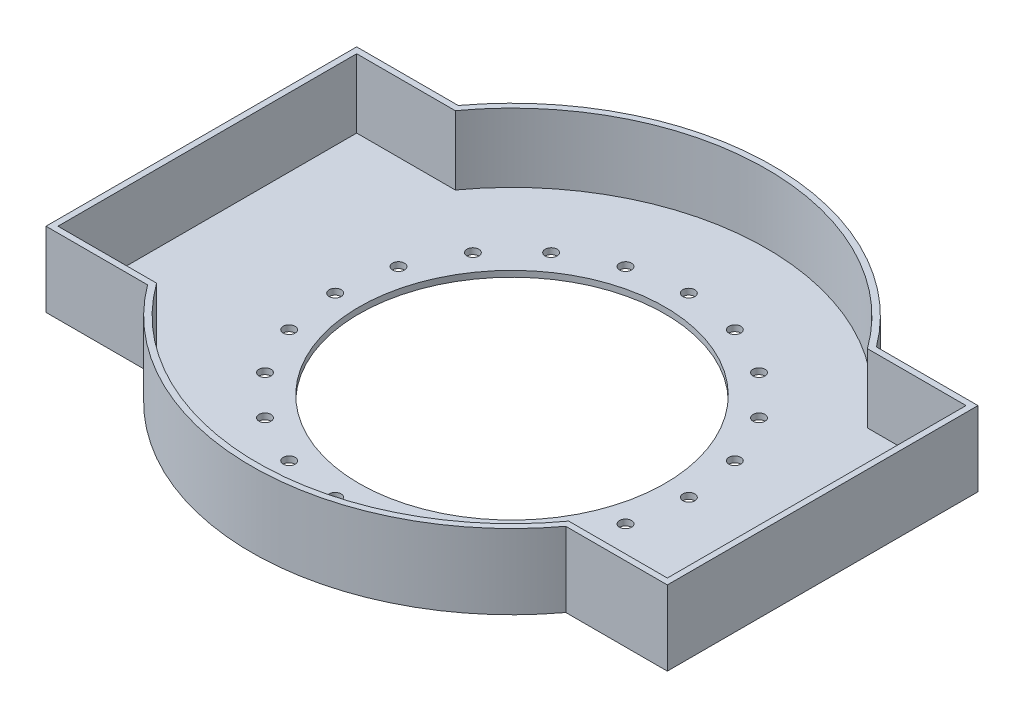
from build123d import *

# Parameters (mm, degrees)
ESQUISSE2_R                  = 10
ENL_V_MAT_EXTRU_1_DEPTH      = 687.62944883
R_P_TITION_CIRCULAIRE1_COUNT = 20
BOSS_EXTRU_1_START           = -10
ESQUISSE5_R                  = 436
ESQUISSE5_R_2                = 336
BOSS_EXTRU_1_DEPTH           = 10
BOSS_EXTRU_2_START           = 115
ESQUISSE6_R                  = 436
ESQUISSE6_R_2                = 426
BOSS_EXTRU_2_DEPTH           = 115
BOSS_EXTRU_3_START           = -10
BOSS_EXTRU_3_DEPTH           = 10
BOSS_EXTRU_4_START           = 115
BOSS_EXTRU_4_DEPTH           = 115
ENL_V_MAT_EXTRU_3_DEPTH      = 115
R_P_TITION_CIRCULAIRE6_COUNT = 2
ESQUISSE10_R                 = 336
ENL_V_MAT_EXTRU_4_DEPTH      = 80


with BuildPart() as part:
    # Esquisse1 → Révolution1 (revolve)
    with BuildSketch(Plane.XY, mode=Mode.PRIVATE) as r_volution1_sk:
        with BuildLine():
            Line((0, 0), (80, 0))
            Line((80, 0), (80, 52.5))
            ThreePointArc((80, 52.5), (70, 62.5), (80, 72.5))
            Line((80, 72.5), (80, 90))
            Line((80, 90), (0, 90))
            Line((0, 90), (0, 0))
        make_face()
    revolve(r_volution1_sk.sketch.rotate(Axis((-256, 27.419354839, 0), (0, -1, 0)), 90), axis=Axis((-256, 27.419354839, 0), (0, -1, 0)))

    # Esquisse2 → Enlèv. mat.-Extru.1 (cut, through all)
    with BuildSketch(Plane.XZ):
        with Locations(Location((40, 0, 0), (0, 0, 270))):
            Circle(ESQUISSE2_R)
    enl_v_mat_extru_1 = extrude(amount=-ENL_V_MAT_EXTRU_1_DEPTH, mode=Mode.SUBTRACT)

    # Répétition circulaire1: Enlèv. mat.-Extru.1 ×20 about axis
    r_p_tition_circulaire1_axis = Axis((-256, 0, 0), (0, 1, 0))
    for i in range(1, R_P_TITION_CIRCULAIRE1_COUNT):
        add(enl_v_mat_extru_1.rotate(r_p_tition_circulaire1_axis, i * 360 / R_P_TITION_CIRCULAIRE1_COUNT), mode=Mode.SUBTRACT)

    # Esquisse5 → Boss.-Extru.1 (add)
    with BuildSketch(Plane.XZ.offset(BOSS_EXTRU_1_START)):
        with Locations(Location((-256, 0, 0), (0, 0, 270))):
            Circle(ESQUISSE5_R)
        with Locations(Location((-256, 0, 0), (0, 0, 90))):
            Circle(ESQUISSE5_R_2, mode=Mode.SUBTRACT)
    extrude(amount=BOSS_EXTRU_1_DEPTH)

    # Esquisse6 → Boss.-Extru.2 (add)
    with BuildSketch(Plane(origin=(0, 10, 0), x_dir=(1, 0, 0), z_dir=(0, 1, 0)).offset(BOSS_EXTRU_2_START)):
        with Locations(Location((-256, 0, 0), (0, 0, 90))):
            Circle(ESQUISSE6_R)
        with Locations(Location((-256, 0, 0), (0, 0, 270))):
            Circle(ESQUISSE6_R_2, mode=Mode.SUBTRACT)
    extrude(amount=-BOSS_EXTRU_2_DEPTH)

    # Esquisse7 → Boss.-Extru.3 (add)
    with BuildSketch(Plane.XZ.offset(BOSS_EXTRU_3_START)):
        with BuildLine():
            Line((93.994285668, 260), (263.994285668, 260))
            Line((263.994285668, 260), (263.994285668, -260))
            Line((263.994285668, -260), (93.994285668, -260))
            ThreePointArc((93.994285668, -260), (180, 0), (93.994285668, 260))
        make_face()
    boss_extru_3 = extrude(amount=BOSS_EXTRU_3_DEPTH)

    # Esquisse8 → Boss.-Extru.4 (add)
    with BuildSketch(Plane(origin=(0, 10, 0), x_dir=(1, 0, 0), z_dir=(0, 1, 0)).offset(BOSS_EXTRU_4_START)):
        with BuildLine():
            Line((113.345366832, 250), (253.994285668, 250))
            Line((253.994285668, 250), (253.994285668, -250))
            Line((253.994285668, -250), (113.345366832, -250))
            Line((113.345366832, -250), (101.205823021, -250))
            ThreePointArc((101.205823021, -250), (97.635403251, -255.025491996), (93.994285668, -260))
            Line((93.994285668, -260), (263.994285668, -260))
            Line((263.994285668, -260), (263.994285668, 260))
            Line((263.994285668, 260), (93.994285668, 260))
            ThreePointArc((93.994285668, 260), (97.635403251, 255.025491996), (101.205823021, 250))
            Line((101.205823021, 250), (113.345366832, 250))
        make_face()
    boss_extru_4 = extrude(amount=-BOSS_EXTRU_4_DEPTH)

    # Esquisse9 → Enlèv. mat.-Extru.3 (cut)
    with BuildSketch(Plane(origin=(0, 125, 0), x_dir=(1, 0, 0), z_dir=(0, 1, 0))):
        with BuildLine():
            Line((101.205823021, -250), (88.928978197, -250))
            ThreePointArc((88.928978197, -250), (170, 0), (88.928978197, 250))
            Line((88.928978197, 250), (101.205823021, 250))
            ThreePointArc((101.205823021, 250), (180, 0), (101.205823021, -250))
        make_face()
    enl_v_mat_extru_3 = extrude(amount=-ENL_V_MAT_EXTRU_3_DEPTH, mode=Mode.SUBTRACT)

    # Répétition circulaire6: Boss.-Extru.3, Boss.-Extru.4, Enlèv. mat.-Extru.3 ×2 about axis
    r_p_tition_circulaire6_axis = Axis((-256, 0, 0), (0, 1, 0))
    add([boss_extru_3.rotate(r_p_tition_circulaire6_axis, i * 360 / R_P_TITION_CIRCULAIRE6_COUNT) for i in range(1, R_P_TITION_CIRCULAIRE6_COUNT)])
    add([boss_extru_4.rotate(r_p_tition_circulaire6_axis, i * 360 / R_P_TITION_CIRCULAIRE6_COUNT) for i in range(1, R_P_TITION_CIRCULAIRE6_COUNT)])
    add([enl_v_mat_extru_3.rotate(r_p_tition_circulaire6_axis, i * 360 / R_P_TITION_CIRCULAIRE6_COUNT) for i in range(1, R_P_TITION_CIRCULAIRE6_COUNT)], mode=Mode.SUBTRACT)

    # Esquisse10 → Enlèv. mat.-Extru.4 (cut)
    with BuildSketch(Plane(origin=(0, 90, 0), x_dir=(1, 0, 0), z_dir=(0, 1, 0))):
        with Locations((-256, 0)):
            Circle(ESQUISSE10_R)
    extrude(amount=-ENL_V_MAT_EXTRU_4_DEPTH, mode=Mode.SUBTRACT)


solid = part.part
